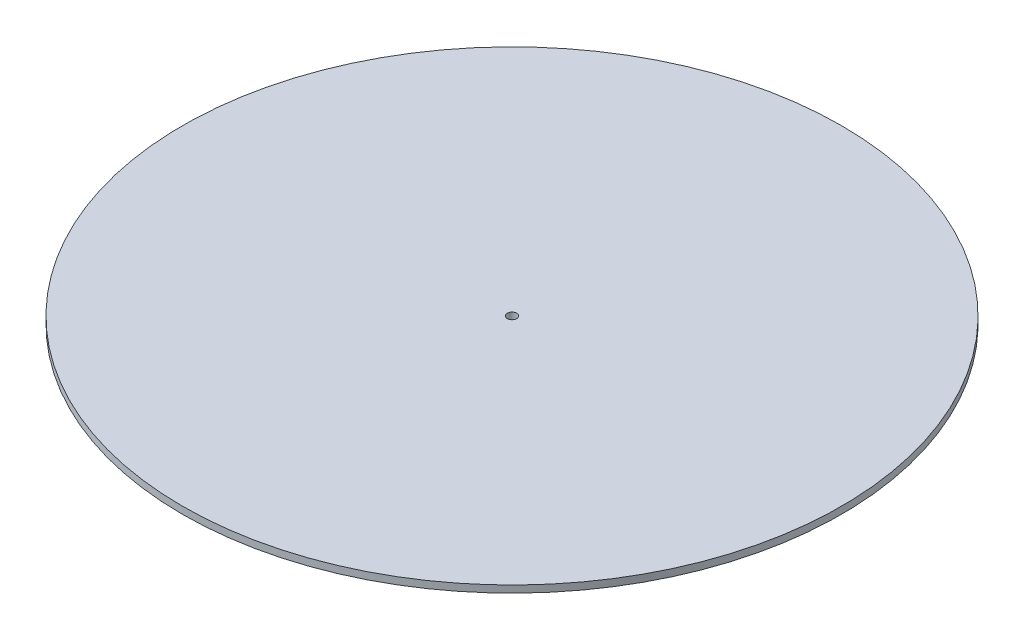
from build123d import *

# Parameters (mm, degrees)
SKETCH1_R           = 140
SKETCH1_R_2         = 2
BOSS_EXTRUDE1_DEPTH = 3


with BuildPart() as part:
    # Sketch1 → Boss-Extrude1 (new body)
    with BuildSketch(Plane(origin=(0, 0, 0), x_dir=(1, 0, 0), z_dir=(0, 1, 0))):
        with Locations(Location((0, 0, 0), (0, 0, 270))):
            Circle(SKETCH1_R)
        with Locations(Location((0, 0, 0), (0, 0, 270))):
            Circle(SKETCH1_R_2, mode=Mode.SUBTRACT)
    extrude(amount=BOSS_EXTRUDE1_DEPTH)


solid = part.part
